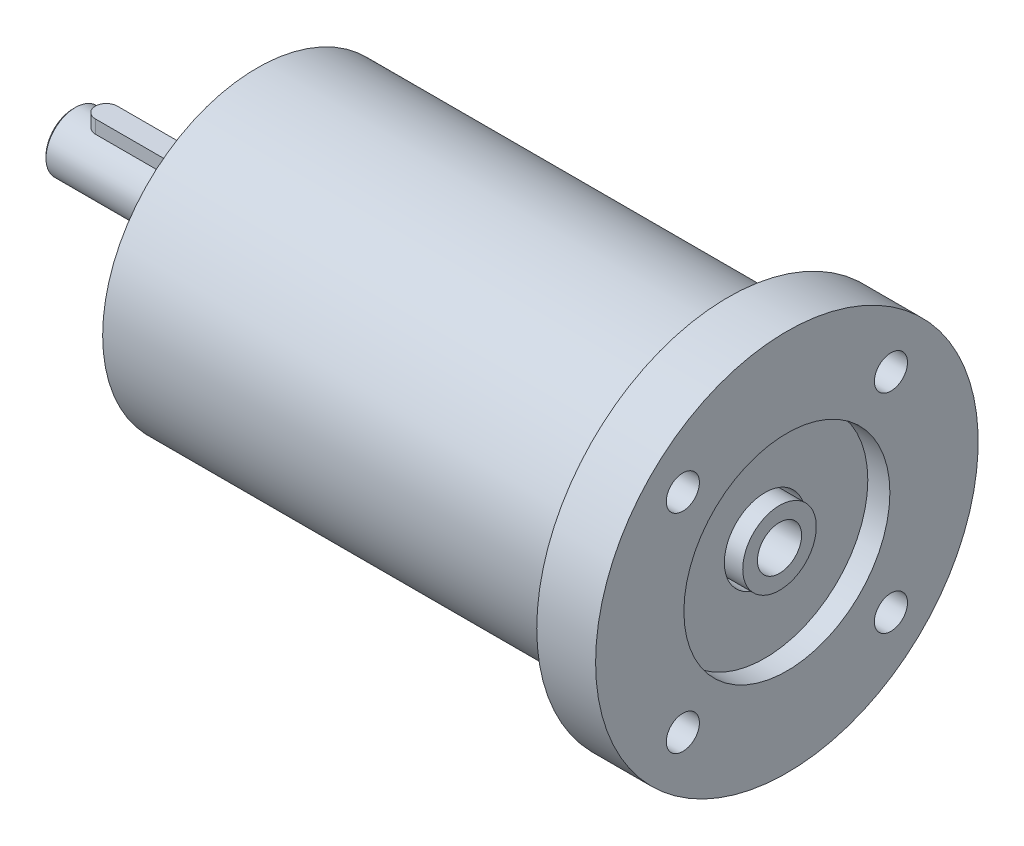
from build123d import *

# Parameters (mm, degrees)
VYSUNOUT1_DEPTH          = 1.5
VYSUNOUT1_DEPTH_BACK     = 2
SKICA4_R                 = 1.6
ODEBRAT_VYSUNUT_M1_DEPTH = 10
KRUHOV_POLE1_COUNT       = 4
SKICA5_R                 = 2.25
ODEBRAT_VYSUNUT_M2_DEPTH = 8


with BuildPart() as part:
    # Skica1 → Rotovat1 (revolve)
    with BuildSketch(Plane.XY, mode=Mode.PRIVATE) as rotovat1_sk:
        Polygon((-25, 1.2), (-25, 3.7), (-24.7, 4), (-2.8, 4), (-2.8, 5), (-2, 5), (-2, 12.5), (0, 12.5), (0, 21), (64, 21), (64, 26), (72, 26), (72, 14), (69, 14), (69, 5.5), (38, 5.5), (38, 0), (33.582268589, 0), (33.582268589, 9.088819243), (61.279825372, 9.088819243), (61.279825372, 15.474623239), (5.76022676, 15.474623239), (5.76022676, 0), (-16.307179677, 0), (-17, 1.2), align=None)
    revolve(rotovat1_sk.sketch.rotate(Axis((-80.036458333, 0, 0), (1, 0, 0)), 90), axis=Axis((-80.036458333, 0, 0), (1, 0, 0)))

    # Skica4 → Odebrat vysunutím1 (cut)
    with BuildSketch(Plane.ZY):
        with Locations((11.313708499, 11.313708499)):
            Circle(SKICA4_R)
    odebrat_vysunut_m1 = extrude(amount=-ODEBRAT_VYSUNUT_M1_DEPTH, mode=Mode.SUBTRACT)

    # Kruhové pole1: Odebrat vysunutím1 ×4 about axis
    kruhov_pole1_axis = Axis((0, 0, 0), (1, 0, 0))
    for i in range(1, KRUHOV_POLE1_COUNT):
        add(odebrat_vysunut_m1.rotate(kruhov_pole1_axis, i * 360 / KRUHOV_POLE1_COUNT), mode=Mode.SUBTRACT)

    # Skica5 → Odebrat vysunutím2 (cut)
    with BuildSketch(Plane(origin=(72, 0, 0), x_dir=(0, 0, -1), z_dir=(1, 0, 0))):
        with Locations((14.142135624, 14.142135624)):
            Circle(SKICA5_R)
        with Locations((14.142135624, -14.142135624)):
            Circle(SKICA5_R)
        with Locations((-14.142135624, -14.142135624)):
            Circle(SKICA5_R)
        with Locations((-14.142135624, 14.142135624)):
            Circle(SKICA5_R)
    extrude(amount=-ODEBRAT_VYSUNUT_M2_DEPTH, mode=Mode.SUBTRACT)


with BuildPart() as body_2:
    # Skica2 → Rotovat2 (revolve)
    with BuildSketch(Plane.XY, mode=Mode.PRIVATE) as rotovat2_sk:
        Polygon((41, 0), (41, 3.5), (53.5, 3.5), (55, 5), (71, 5), (71, 3), (57, 3), (55.267949192, 0), align=None)
    revolve(rotovat2_sk.sketch.rotate(Axis((0, 0, 0), (1, 0, 0)), 90), axis=Axis((0, 0, 0), (1, 0, 0)))


with BuildPart() as body_3:
    # Skica3 → Vysunout1 (new, two sides: drawn at the far end of the back side and taken through both)
    with BuildSketch(Plane(origin=(-13.75, 4, 0), x_dir=(0, 0, -1), z_dir=(0, 1, 0)).offset(-VYSUNOUT1_DEPTH_BACK)):
        with BuildLine():
            Line((1.5, -6.25), (1.5, 6.75))
            ThreePointArc((1.5, 6.75), (0, 8.25), (-1.5, 6.75))
            Line((-1.5, 6.75), (-1.5, -6.25))
            ThreePointArc((-1.5, -6.25), (0, -7.75), (1.5, -6.25))
        make_face()
    extrude(amount=VYSUNOUT1_DEPTH + VYSUNOUT1_DEPTH_BACK)


solid = Compound([part.part, body_2.part, body_3.part])
